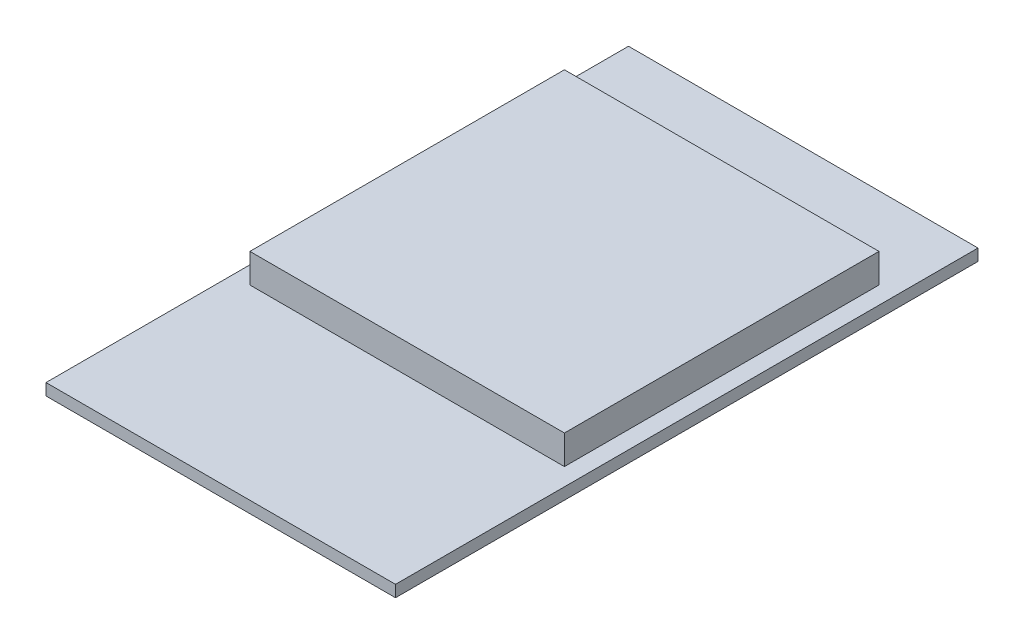
from build123d import *

# Parameters (mm, degrees)
SKETCH1_W           = 30
SKETCH1_H           = 50
BOSS_EXTRUDE1_DEPTH = 1
SKETCH2_W           = 27
SKETCH2_H           = 27
BOSS_EXTRUDE2_DEPTH = 2.5


with BuildPart() as part:
    # Sketch1 → Boss-Extrude1 (new body)
    with BuildSketch(Plane(origin=(0, 0, 0), x_dir=(1, 0, 0), z_dir=(0, 1, 0))):
        with Locations((15, 25)):
            Rectangle(SKETCH1_W, SKETCH1_H)
    extrude(amount=BOSS_EXTRUDE1_DEPTH)

    # Sketch2 → Boss-Extrude2 (add)
    with BuildSketch(Plane(origin=(0, 1, 0), x_dir=(1, 0, 0), z_dir=(0, 1, 0))):
        with Locations((15, 29.5)):
            Rectangle(SKETCH2_W, SKETCH2_H)
    extrude(amount=BOSS_EXTRUDE2_DEPTH)


solid = part.part
